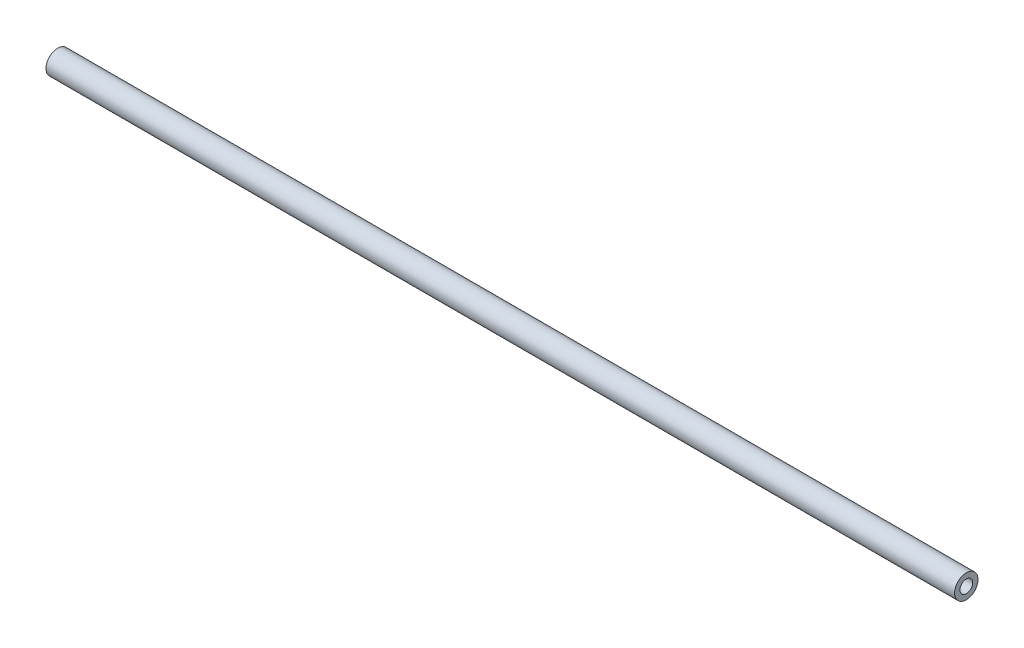
from build123d import *

# Parameters (mm, degrees)
SKETCH1_R           = 3.175
BOSS_EXTRUDE1_DEPTH = 123.19


with BuildPart() as part:
    # Sketch1 → Boss-Extrude1 (new, symmetric)
    with BuildSketch(Plane(origin=(0, 0, 0), x_dir=(0, 0, -1), z_dir=(1, 0, 0))):
        with Locations(Location((0, 0, 0), (0, 0, 180))):
            Circle(SKETCH1_R)
    extrude(amount=BOSS_EXTRUDE1_DEPTH, both=True)

    # Sketch4 → Tap Drill for #8-32 Tap1 (revolve, cut)
    with BuildSketch(Plane(origin=(123.19, 0, 0), x_dir=(0, 0, -1), z_dir=(0, 1, 0))):
        Polygon((0, 0), (0, 11.197806461), (1.7272, 10.16), (1.7272, 0), align=None)
    tap_drill_for_8_32_tap1 = revolve(axis=Axis((129.54, 0, 0), (-1, 0, 0)), mode=Mode.SUBTRACT)

    # Mirror1: Tap Drill for #8-32 Tap1 across plane
    add(tap_drill_for_8_32_tap1.mirror(Plane(origin=(0, 0, 0), x_dir=(0, 0, 1), z_dir=(1, 0, 0))), mode=Mode.SUBTRACT)


solid = part.part
